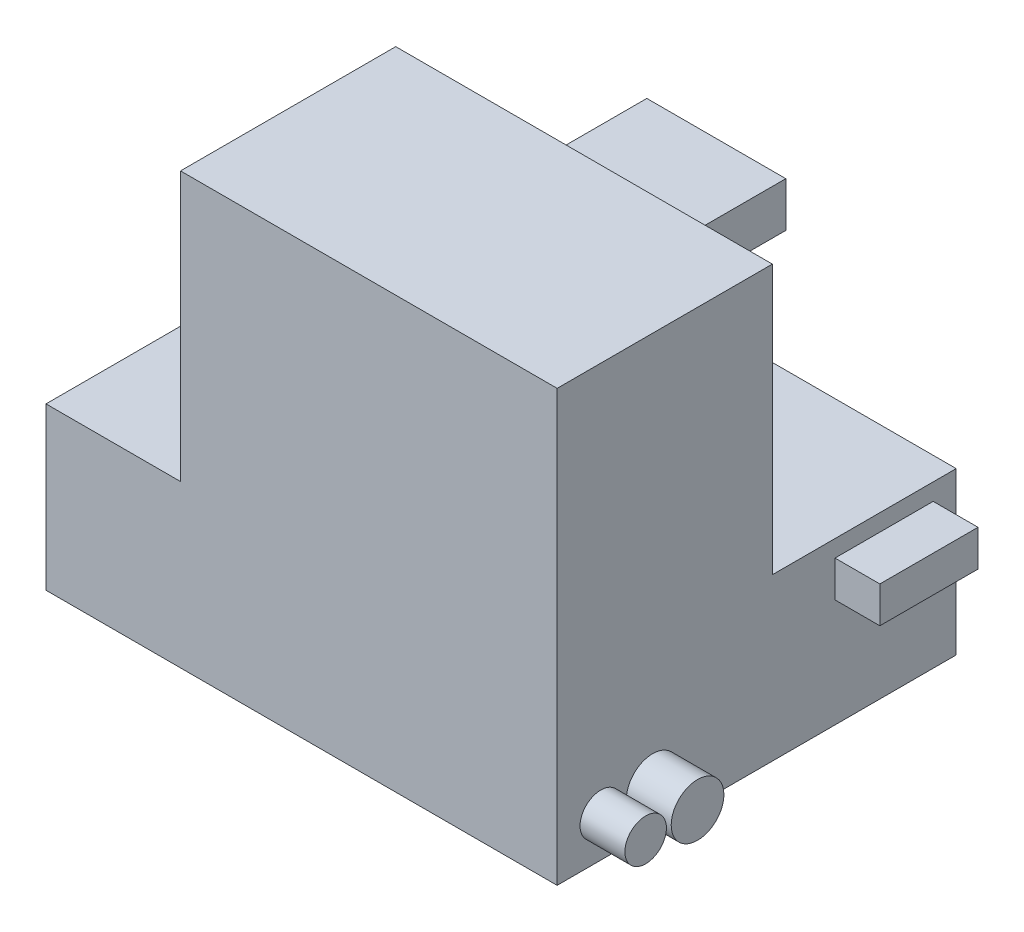
from build123d import *

# Parameters (mm, degrees)
SKETCH1_W           = 57
SKETCH1_H           = 44.5
BOSS_EXTRUDE1_DEPTH = 18
SKETCH2_R           = 2.314555985
SKETCH2_R_2         = 2.937250919
SKETCH2_W           = 10.945123542
SKETCH2_H           = 4.040448377
BOSS_EXTRUDE2_DEPTH = 5
SKETCH3_W           = 42
SKETCH3_H           = 24
BOSS_EXTRUDE3_DEPTH = 30
SKETCH4_W           = 15.5
SKETCH4_H           = 5
BOSS_EXTRUDE4_DEPTH = 20
SKETCH5_R           = 1.7
CUT_EXTRUDE1_DEPTH  = 10


with BuildPart() as part:
    # Sketch1 → Boss-Extrude1 (new body)
    with BuildSketch(Plane(origin=(0, 0, 0), x_dir=(1, 0, 0), z_dir=(0, 1, 0))):
        with Locations((28.5, 22.25)):
            Rectangle(SKETCH1_W, SKETCH1_H)
    extrude(amount=BOSS_EXTRUDE1_DEPTH)

    # Sketch2 → Boss-Extrude2 (add)
    with BuildSketch(Plane(origin=(57, 0, 0), x_dir=(0, 0, -1), z_dir=(1, 0, 0))):
        with Locations(Location((4.869948731, 4.458338777, 0), (0, 0, 180))):
            Circle(SKETCH2_R)
        with Locations(Location((10.656338694, 4.458338777, 0), (0, 0, 180))):
            Circle(SKETCH2_R_2)
        with Locations((36.458792801, 14.096318992)):
            Rectangle(SKETCH2_W, SKETCH2_H)
    extrude(amount=BOSS_EXTRUDE2_DEPTH)

    # Sketch3 → Boss-Extrude3 (add)
    with BuildSketch(Plane(origin=(0, 18, 0), x_dir=(1, 0, 0), z_dir=(0, 1, 0))):
        with Locations((36, 12)):
            Rectangle(SKETCH3_W, SKETCH3_H)
    extrude(amount=BOSS_EXTRUDE3_DEPTH)

    # Sketch4 → Boss-Extrude4 (add)
    with BuildSketch(Plane(origin=(0, 0, -44.5), x_dir=(-1, 0, 0), z_dir=(0, 0, -1))):
        with Locations((-10.25, 14)):
            Rectangle(SKETCH4_W, SKETCH4_H)
    extrude(amount=BOSS_EXTRUDE4_DEPTH)

    # Sketch5 → Cut-Extrude1 (cut)
    with BuildSketch(Plane.XZ):
        with Locations(Location((3.66, -3.81, 0), (0, 0, 270))):
            Circle(SKETCH5_R)
        with Locations(Location((16.36, -40.64, 0), (0, 0, 270))):
            Circle(SKETCH5_R)
        with Locations(Location((53.19, -19.05, 0), (0, 0, 270))):
            Circle(SKETCH5_R)
    extrude(amount=-CUT_EXTRUDE1_DEPTH, mode=Mode.SUBTRACT)


solid = part.part
